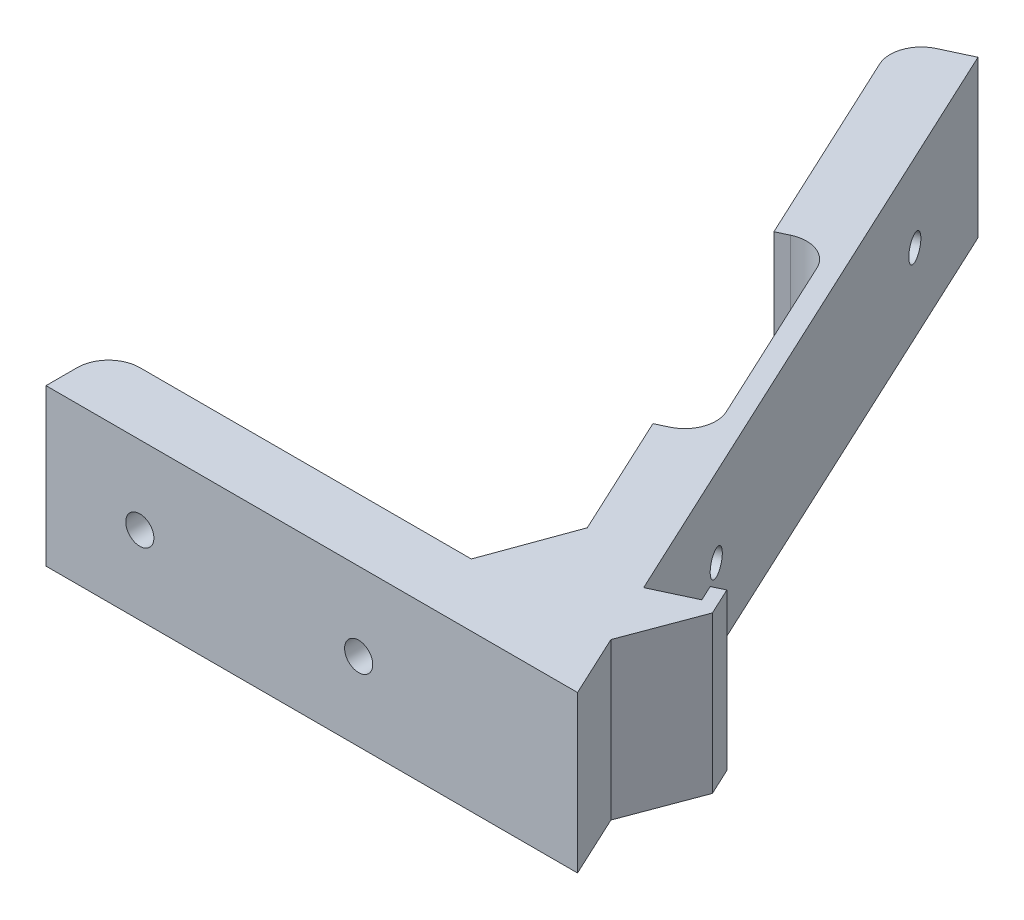
from build123d import *

# Parameters (mm, degrees)
BOSS_EXTRUDE1_DEPTH = 25
FILLET3_R           = 5
FILLET4_R           = 5
FILLET6_R           = 5
FILLET7_R           = 5
SKETCH3_R           = 2
CUT_EXTRUDE1_DEPTH  = 10
SKETCH4_R           = 2.25
CUT_EXTRUDE2_DEPTH  = 10


with BuildPart() as part:
    # Sketch1 → Boss-Extrude1 (new body)
    with BuildSketch(Plane(origin=(0, 0, 0), x_dir=(1, 0, 0), z_dir=(0, 1, 0))):
        Polygon((-36.558892084, -26.613857404), (-36.558892084, -36.613857404), (48.441107916, -36.613857404), (43.778031334, -26.613857404), (48.203540535, -14.808578263), (46.184421194, -10.478562864), (44.37180562, -11.323799388), (45.545688437, -13.841199212), (39.201533928, -16.799527044), (-7.515811063, 83.386142596), (-16.578888933, 79.159959979), (0.325841536, 42.907648497), (6.669996046, 45.86597633), (23.574726515, 9.613664848), (17.230572006, 6.655337016), (26.404978218, -13.019240598), (21.456942355, -26.613857404), align=None)
    extrude(amount=BOSS_EXTRUDE1_DEPTH)

    # Fillet3
    fillet3_edges = [part.edges().sort_by_distance(p)[0] for p in [
        (-16.578888933, 12.5, -79.159959979),
    ]]
    fillet(fillet3_edges, radius=FILLET3_R)

    # Fillet4
    fillet4_edges = [part.edges().sort_by_distance(p)[0] for p in [
        (-36.558892084, 12.5, 26.613857404),
    ]]
    fillet(fillet4_edges, radius=FILLET4_R)

    # Fillet6
    fillet6_edges = [part.edges().sort_by_distance(p)[0] for p in [
        (23.574726515, 12.5, -9.613664848),
    ]]
    fillet(fillet6_edges, radius=FILLET6_R)

    # Fillet7
    fillet7_edges = [part.edges().sort_by_distance(p)[0] for p in [
        (6.669996046, 12.5, -45.86597633),
    ]]
    fillet(fillet7_edges, radius=FILLET7_R)

    # Sketch3 → Cut-Extrude1 (cut)
    with BuildSketch(Plane(origin=(25.765304939, 0, -12.014559008), x_dir=(-0.422618261740704, 0, -0.9063077870366479), z_dir=(0.9063077870366479, 0, -0.422618261740704))):
        with Locations((57.857173695, 12.5)):
            Circle(SKETCH3_R)
        with Locations((-7.792826305, 12.5)):
            Circle(SKETCH3_R)
    extrude(amount=-CUT_EXTRUDE1_DEPTH, mode=Mode.SUBTRACT)

    # Sketch4 → Cut-Extrude2 (cut)
    with BuildSketch(Plane.XY.offset(36.613857404)):
        with Locations((-21.558892084, 12.5)):
            Circle(SKETCH4_R)
        with Locations((13.441107916, 12.5)):
            Circle(SKETCH4_R)
    extrude(amount=-CUT_EXTRUDE2_DEPTH, mode=Mode.SUBTRACT)


solid = part.part
